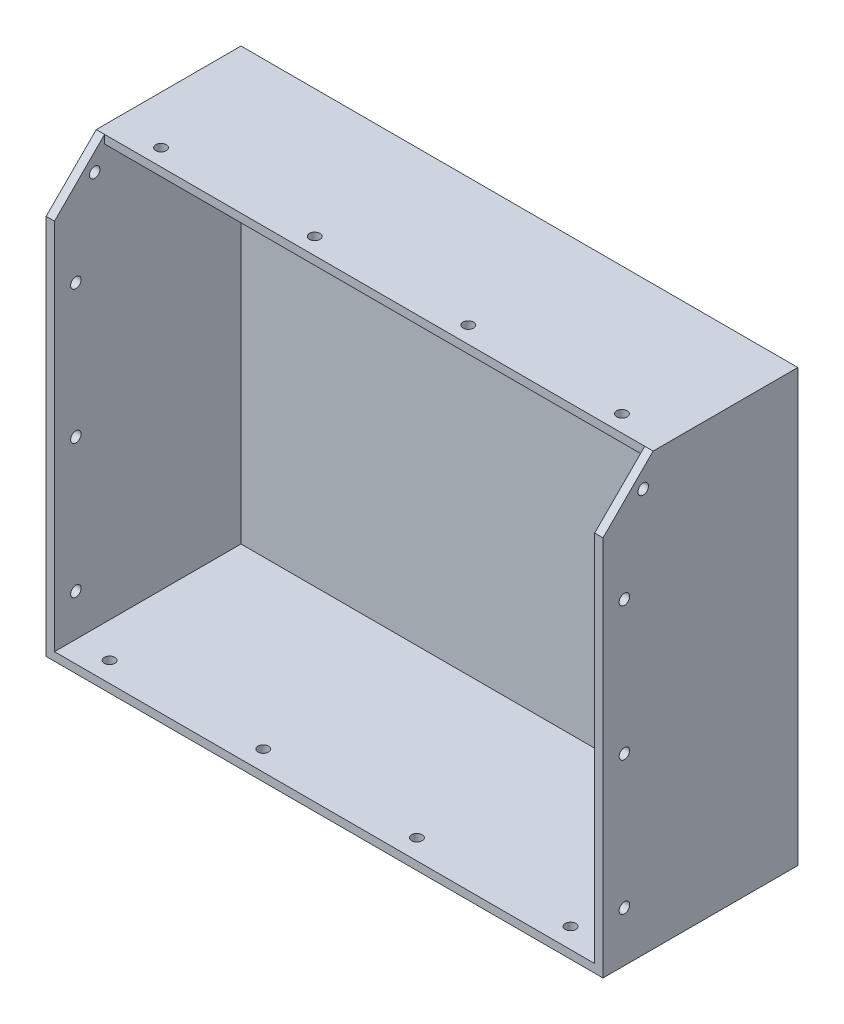
from build123d import *

# Parameters (mm, degrees)
SKETCH2_W                = 211.751333334
SKETCH2_H                = 164
BOSS_EXTRUDE1_DEPTH      = 74.083333333
CUT_EXTRUDE7_DEPTH       = 70.90833333
CUT_EXTRUDE9_REACH       = 240.853
CUT_EXTRUDE10_DEPTH      = 3.175
SKETCH14_W               = 205.401333334
SKETCH14_H               = 3.175
CUT_EXTRUDE11_DEPTH      = 3.175
CUT_EXTRUDE12_DEPTH      = 239.853443446
CUT_EXTRUDE12_DEPTH_BACK = 3.175
SKETCH16_R               = 2
CUT_EXTRUDE13_DEPTH      = 239.853443446
LPATTERN1_COUNT          = 3
LPATTERN1_PITCH          = 50.8
CUT_EXTRUDE14_REACH      = 210.792
SKETCH18_R               = 2
LPATTERN2_COUNT          = 4
LPATTERN2_PITCH          = 58.42
CUT_EXTRUDE15_REACH      = 210.792
SKETCH19_R               = 2
LPATTERN3_COUNT          = 4
LPATTERN3_PITCH          = 58.42
SKETCH20_R               = 2
CUT_EXTRUDE16_DEPTH      = 239.853443446


with BuildPart() as part:
    # Sketch2 → Boss-Extrude1 (new body)
    with BuildSketch(Plane.XY):
        Rectangle(SKETCH2_W, SKETCH2_H)
    extrude(amount=BOSS_EXTRUDE1_DEPTH)

    # Sketch9 → Cut-Extrude7 (cut)
    with BuildSketch(Plane.XY.offset(74.083333333)):
        Polygon((-102.700666667, 62.95), (-102.700666667, -47.748173381), (-102.700666667, -78.825), (-61.266487403, -78.825), (102.700666667, -78.825), (102.700666667, -21.962957065), (102.700666667, 78.825), (-87.76182231, 78.825), (-102.700666667, 78.825), align=None)
    extrude(amount=-CUT_EXTRUDE7_DEPTH, mode=Mode.SUBTRACT)

    # Sketch11 → Cut-Extrude9 (cut, up to next)
    with BuildSketch(Plane.ZY.offset(105.875666667), mode=Mode.PRIVATE) as cut_extrude9_sk1:
        Polygon((58.208333333, 78.825), (74.083333333, 62.95), (74.083333333, 82), (58.208333333, 82), (58.208333333, 79.62382388), align=None)
    cut_extrude9_tool1 = extrude(cut_extrude9_sk1.sketch, amount=-CUT_EXTRUDE9_REACH, mode=Mode.PRIVATE) & part.part
    add(cut_extrude9_tool1.solids().sort_by_distance((-105.875667, 75.49881, 68.035714))[0], mode=Mode.SUBTRACT)

    # Sketch13 → Cut-Extrude10 (cut)
    with BuildSketch(Plane.ZY.offset(105.875666667)):
        Polygon((58.208333333, 78.825), (55.033333333, 82), (58.208333333, 82), align=None)
    extrude(amount=-CUT_EXTRUDE10_DEPTH, mode=Mode.SUBTRACT)

    # Sketch14 → Cut-Extrude11 (cut)
    with BuildSketch(Plane.XY.offset(58.208333333)):
        with Locations((0, 80.4125)):
            Rectangle(SKETCH14_W, SKETCH14_H)
    extrude(amount=-CUT_EXTRUDE11_DEPTH, mode=Mode.SUBTRACT)

    # Sketch15 → Cut-Extrude12 (cut, two sides: drawn at the far end of the back side and taken through both)
    with BuildSketch(Plane(origin=(105.875666667, 0, 0), x_dir=(0, 0, -1), z_dir=(1, 0, 0)).offset(-CUT_EXTRUDE12_DEPTH_BACK)):
        Polygon((-58.208333333, 79.215720039), (-58.208333333, 78.825), (-55.033333333, 82), (-58.208333333, 82), align=None)
    extrude(amount=CUT_EXTRUDE12_DEPTH + CUT_EXTRUDE12_DEPTH_BACK, mode=Mode.SUBTRACT)

    # Sketch16 → Cut-Extrude13 (cut, through all)
    with BuildSketch(Plane.ZY.offset(105.875666667)):
        with Locations((65.955333333, -62.95)):
            Circle(SKETCH16_R)
    cut_extrude13 = extrude(amount=-CUT_EXTRUDE13_DEPTH, mode=Mode.SUBTRACT)

    # LPattern1: Cut-Extrude13 ×3
    with Locations(*[(0, i * LPATTERN1_PITCH, 0) for i in range(1, LPATTERN1_COUNT)]):
        add(cut_extrude13, mode=Mode.SUBTRACT)

    # Sketch18 → Cut-Extrude14 (cut, up to next)
    with BuildSketch(Plane.XZ.offset(82), mode=Mode.PRIVATE) as cut_extrude14_sk1:
        with Locations(Location((-89.365666667, 66.463333333, 0), (0, 0, 270))):
            Circle(SKETCH18_R)
    cut_extrude14_tool1 = extrude(cut_extrude14_sk1.sketch, amount=-CUT_EXTRUDE14_REACH, mode=Mode.PRIVATE) & part.part
    cut_extrude14 = cut_extrude14_tool1.solids().sort_by_distance((-89.365667, -82, 66.463333))[0]
    add(cut_extrude14, mode=Mode.SUBTRACT)

    # LPattern2: Cut-Extrude14 ×4
    with Locations(*[(i * LPATTERN2_PITCH, 0, 0) for i in range(1, LPATTERN2_COUNT)]):
        add(cut_extrude14, mode=Mode.SUBTRACT)

    # Sketch19 → Cut-Extrude15 (cut, up to next)
    with BuildSketch(Plane(origin=(0, 82, 0), x_dir=(1, 0, 0), z_dir=(0, 1, 0)), mode=Mode.PRIVATE) as cut_extrude15_sk1:
        with Locations(Location((-87.587666667, -48.683333333, 0), (0, 0, 270))):
            Circle(SKETCH19_R)
    cut_extrude15_tool1 = extrude(cut_extrude15_sk1.sketch, amount=-CUT_EXTRUDE15_REACH, mode=Mode.PRIVATE) & part.part
    cut_extrude15 = cut_extrude15_tool1.solids().sort_by_distance((-87.587667, 82, 48.683333))[0]
    add(cut_extrude15, mode=Mode.SUBTRACT)

    # LPattern3: Cut-Extrude15 ×4
    with Locations(*[(i * LPATTERN3_PITCH, 0, 0) for i in range(1, LPATTERN3_COUNT)]):
        add(cut_extrude15, mode=Mode.SUBTRACT)

    # Sketch20 → Cut-Extrude16 (cut, through all)
    with BuildSketch(Plane.ZY.offset(105.875666667)):
        with Locations((58.805040904, 71.403297777)):
            Circle(SKETCH20_R)
    extrude(amount=-CUT_EXTRUDE16_DEPTH, mode=Mode.SUBTRACT)


solid = part.part
